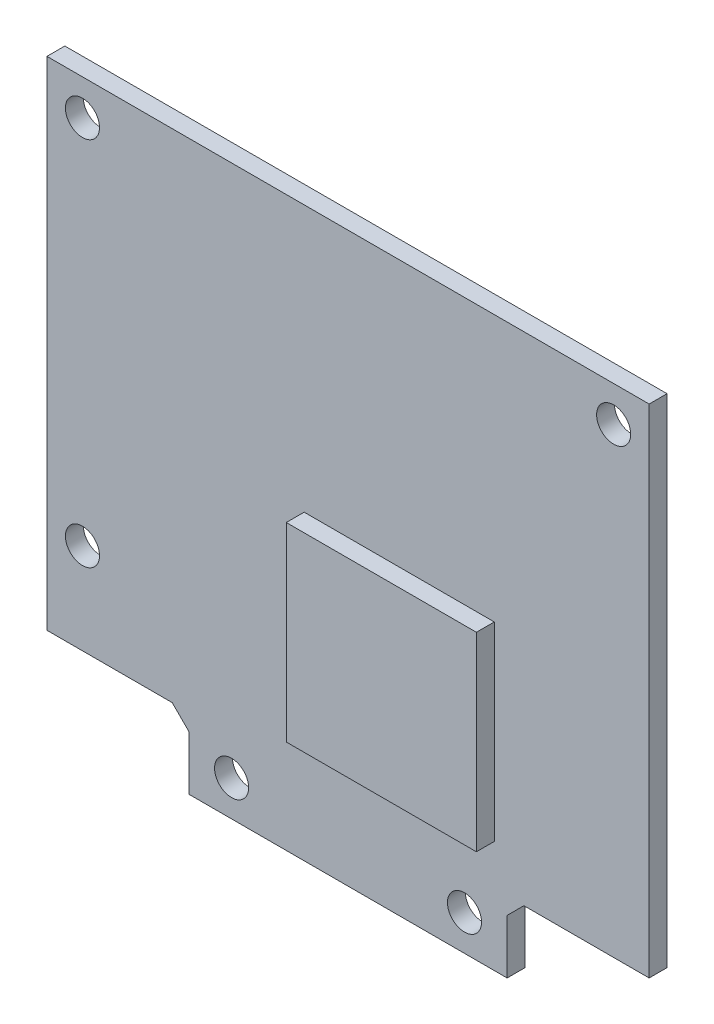
from build123d import *

# Parameters (mm, degrees)
EXTRUDE1_DEPTH = 1.6
SKETCH2_R      = 1.524
EXTRUDE2_DEPTH = 49.45956434
SKETCH4_W      = 17
SKETCH4_H      = 17
EXTRUDE3_DEPTH = 1.6


with BuildPart() as part:
    # Sketch1 → Extrude1 (new body)
    with BuildSketch(Plane.XY):
        Polygon((15.724, -33.91), (26.924, -33.91), (26.924, 10.54), (-26.924, 10.54), (-26.924, -33.91), (-15.724, -33.91), (-14.224, -35.41), (-14.224, -40.26), (14.224, -40.26), (14.224, -35.41), align=None)
    extrude(amount=EXTRUDE1_DEPTH)

    # Sketch2 → Extrude2 (cut, through all)
    with BuildSketch(Plane.XY):
        with Locations((23.749, 7.365)):
            Circle(SKETCH2_R)
        with Locations((10.414, -37.085)):
            Circle(SKETCH2_R)
        with Locations((-10.414, -37.085)):
            Circle(SKETCH2_R)
        with Locations((-23.749, -25.782)):
            Circle(SKETCH2_R)
        with Locations((-23.749, 7.365)):
            Circle(SKETCH2_R)
    extrude(amount=EXTRUDE2_DEPTH, mode=Mode.SUBTRACT)

    # Sketch4 → Extrude3 (add)
    with BuildSketch(Plane.XY.offset(1.6)):
        with Locations((4.576, -21.76)):
            Rectangle(SKETCH4_W, SKETCH4_H)
    extrude(amount=EXTRUDE3_DEPTH)


solid = part.part
